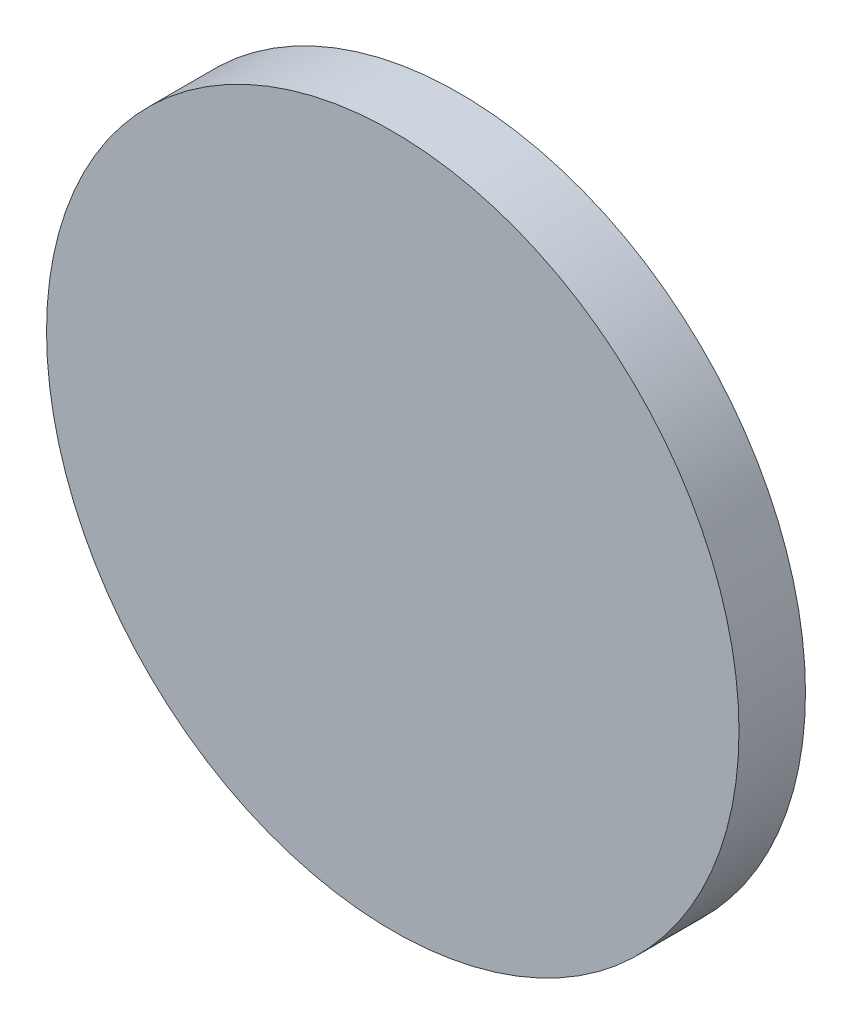
from build123d import *

# Parameters (mm, degrees)
SKETCH1_R           = 12.5
BOSS_EXTRUDE1_DEPTH = 2.4


with BuildPart() as part:
    # Sketch1 → Boss-Extrude1 (new body)
    with BuildSketch(Plane.XY):
        Circle(SKETCH1_R)
    extrude(amount=BOSS_EXTRUDE1_DEPTH)


solid = part.part
